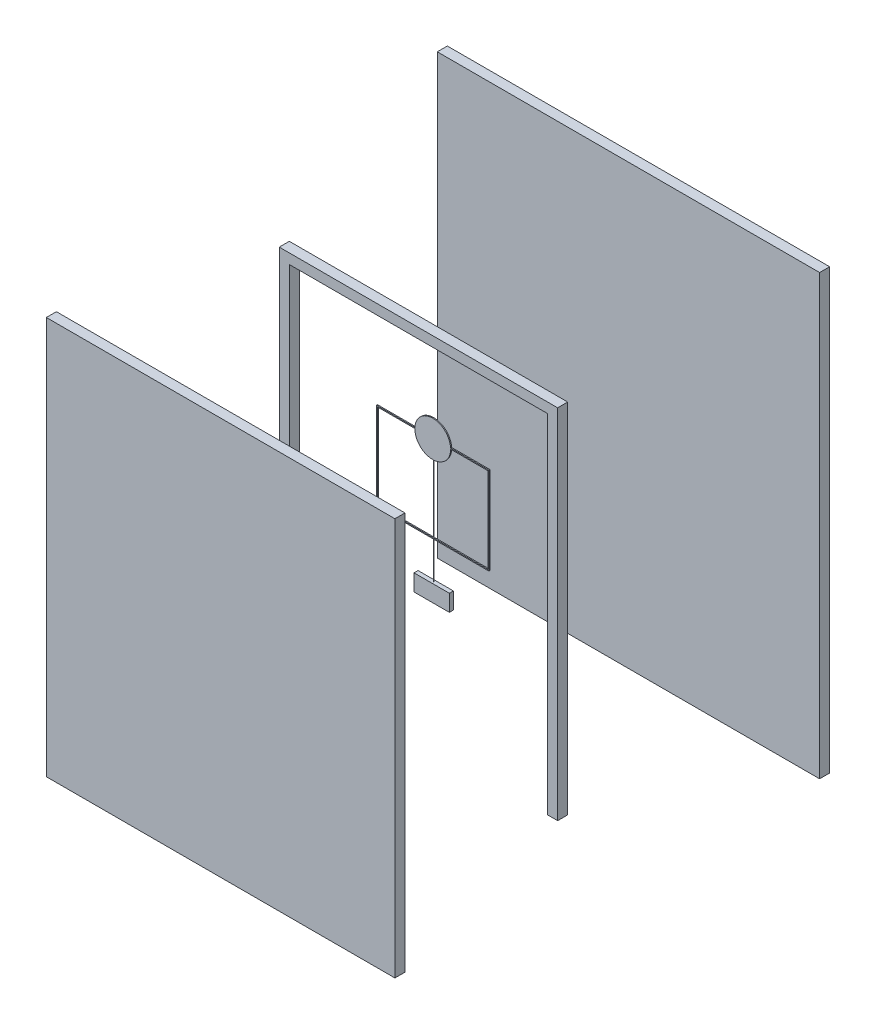
from build123d import *

# Parameters (mm, degrees)
SKETCH_1_W        = 5
SKETCH_1_H        = 172.993722334
EXTRUDE_1_DEPTH   = 5
EXTRUDE_1_2_DEPTH = 5
EXTRUDE_2_DEPTH   = 5
SKETCH_3_W        = 0.1
SKETCH_3_H        = 34.98253205
EXTRUDE_3_DEPTH   = 0.1
SKETCH_5_R        = 8.919313786
EXTRUDE_1_3_DEPTH = 0.5
EXTRUDE_4_DEPTH   = 0.5
SKETCH_7_W        = 0.1
SKETCH_7_H        = 52.993522993
EXTRUDE_6_DEPTH   = 0.1
EXTRUDE_3_2_DEPTH = 1
SKETCH_9_W        = 173.503354497
SKETCH_9_H        = 197.988407328
EXTRUDE_4_2_DEPTH = 2.5
SKETCH_11_W       = 190.301069936
SKETCH_11_H       = 218.259854491
EXTRUDE_5_DEPTH   = 2.5


with BuildPart() as part:
    # 草图1 → Extrude 1 (new body)
    with BuildSketch(Plane.XY):
        with Locations((-69.283623041, 0)):
            Rectangle(SKETCH_1_W, SKETCH_1_H)
    extrude(amount=EXTRUDE_1_DEPTH)



with BuildPart() as body_2:
    # 草图1 → Extrude 1 2 (new body)
    with BuildSketch(Plane.XY):
        with Locations((64.283623041, 0)):
            Rectangle(SKETCH_1_W, SKETCH_1_H)
    extrude(amount=EXTRUDE_1_2_DEPTH)


with BuildPart() as part_1:
    add(part.part)

    add(body_2.part)  # 拉伸-薄壁2 merges body 2
    # 草图2 → 拉伸-薄壁2 (add)
    with BuildSketch(Plane.XY.offset(5)):
        Polygon((-71.783623041, 86.496861167), (-69.283623041, 86.496861167), (64.283623041, 86.496861167), (66.783623041, 86.496861167), (66.783623041, 91.496861167), (64.283623041, 91.496861167), (-69.283623041, 91.496861167), (-71.783623041, 91.496861167), align=None)
    extrude(amount=-EXTRUDE_2_DEPTH)

    # 草图3 → Extrude 3 (add)
    with BuildSketch(Plane(origin=(0, 0, 0), x_dir=(-1, 0, 0), z_dir=(0, 0, -1))):
        with Locations((-0.05, 69.005595142)):
            Rectangle(SKETCH_3_W, SKETCH_3_H)
    extrude(amount=-EXTRUDE_3_DEPTH)


with BuildPart() as body_2_2:
    # 草图5 → Extrude 1 3 (new body)
    with BuildSketch(Plane(origin=(0, 0, 0), x_dir=(-1, 0, 0), z_dir=(0, 0, -1))):
        with Locations((-0.1, 42.522226632)):
            Circle(SKETCH_5_R)
    extrude(amount=-EXTRUDE_1_3_DEPTH)


with BuildPart() as body_3:
    # 草图6 → Extrude 4 (new body)
    with BuildSketch(Plane(origin=(0, 0, 0), x_dir=(-1, 0, 0), z_dir=(0, 0, -1))):
        Polygon((8.819313786, 42.522226632), (27.412546228, 42.522226632), (27.412546228, 0), (-27.612546228, 0), (-27.612546228, 42.522226632), (-9.019313786, 42.522226632), (-9.019313786, 43.022226632), (-28.112546228, 43.022226632), (-28.112546228, -0.5), (27.912546228, -0.5), (27.912546228, 43.022226632), (8.819313786, 43.022226632), align=None)
    extrude(amount=-EXTRUDE_4_DEPTH)

    # 草图7 → 拉伸-薄壁6 (add)
    with BuildSketch(Plane(origin=(0, 0, 0), x_dir=(-1, 0, 0), z_dir=(0, 0, -1))):
        with Locations((-0.15, 7.10615135)):
            Rectangle(SKETCH_7_W, SKETCH_7_H)
    extrude(amount=EXTRUDE_6_DEPTH)

    # 草图8 → Extrude 3 2 (add, symmetric)
    with BuildSketch(Plane(origin=(0, 0, 0), x_dir=(-1, 0, 0), z_dir=(0, 0, -1))):
        Polygon((0, -19.390610147), (-0.2, -19.390610147), (-8.891283678, -19.390610147), (-8.891283678, -27.645655051), (8.691283678, -27.645655051), (8.691283678, -19.390610147), align=None)
    extrude(amount=EXTRUDE_3_2_DEPTH, both=True)


with BuildPart() as body_4:
    # 草图9 → Extrude 4 2 (new, symmetric)
    with BuildSketch(Plane.XY.offset(100)):
        with Locations((-3.472916007, 1.689236661)):
            Rectangle(SKETCH_9_W, SKETCH_9_H)
    extrude(amount=EXTRUDE_4_2_DEPTH, both=True)


with BuildPart() as body_5:
    # 草图11 → 凸台-拉伸5 (new, symmetric)
    with BuildSketch(Plane.XY.offset(-100)):
        with Locations((-0.475210299, 3.382475522)):
            Rectangle(SKETCH_11_W, SKETCH_11_H)
    extrude(amount=EXTRUDE_5_DEPTH, both=True)


solid = Compound([part_1.part, body_2_2.part, body_3.part, body_4.part, body_5.part])
